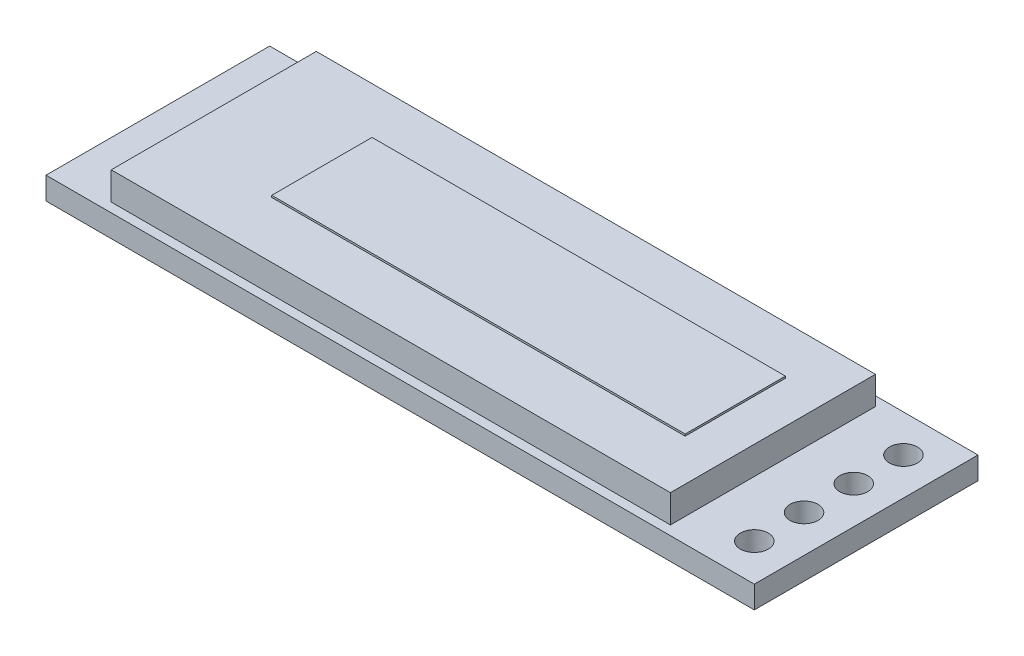
from build123d import *

# Parameters (mm, degrees)
SKETCH_1_W          = 38
SKETCH_1_H          = 12
EXTRUDE_1_DEPTH     = 1.2
SKETCH_2_W          = 30
SKETCH_2_H          = 11
EXTRUDE_2_DEPTH     = 2.7
SKETCH_3_R          = 0.75
CUT_EXTRUDE_2_DEPTH = 39.565399
EXTRUDE_START       = 1.2
SKETCH_4_W          = 2
SKETCH_4_H          = 10
SKETCH_4_H_2        = 1.370131764
EXTRUDE_3_DEPTH     = 2
SKETCH_5_W          = 22.18
SKETCH_5_H          = 5.38
EXTRUDE_4_DEPTH     = 0.1


with BuildPart() as part:
    # Эскиз1 → Бобышка-Вытянуть1 (new body)
    with BuildSketch(Plane(origin=(0, 0, 0), x_dir=(1, 0, 0), z_dir=(0, 1, 0))):
        with Locations((-19, 0)):
            Rectangle(SKETCH_1_W, SKETCH_1_H)
    extrude(amount=EXTRUDE_1_DEPTH)

    # Эскиз2 → Бобышка-Вытянуть2 (add)
    with BuildSketch(Plane(origin=(0, 0, 0), x_dir=(1, 0, 0), z_dir=(0, 1, 0))):
        with Locations((-20, 0)):
            Rectangle(SKETCH_2_W, SKETCH_2_H)
    extrude(amount=EXTRUDE_2_DEPTH)

    # Эскиз3 → Вырез-Вытянуть2 (cut, through all)
    with BuildSketch(Plane(origin=(0, 0, 0), x_dir=(1, 0, 0), z_dir=(0, 1, 0))):
        with Locations(Location((-2, 4, 0), (0, 0, 90))):
            Circle(SKETCH_3_R)
        with Locations(Location((-2, 1.333333333, 0), (0, 0, 90))):
            Circle(SKETCH_3_R)
        with Locations(Location((-2, -1.333333333, 0), (0, 0, 90))):
            Circle(SKETCH_3_R)
        with Locations(Location((-2, -4, 0), (0, 0, 90))):
            Circle(SKETCH_3_R)
    extrude(amount=CUT_EXTRUDE_2_DEPTH, mode=Mode.SUBTRACT)

    # Эскиз4 → Бобышка-Вытянуть3 (add)
    with BuildSketch(Plane(origin=(0, 0, 0), x_dir=(1, 0, 0), z_dir=(0, 1, 0)).offset(EXTRUDE_START)):
        with Locations((-23, 0)):
            Rectangle(SKETCH_4_W, SKETCH_4_H)
        with Locations((-16, 0)):
            Rectangle(SKETCH_4_W, SKETCH_4_H)
        with Locations((-10.327262123, 1.918184469)):
            Rectangle(SKETCH_4_W, SKETCH_4_H_2)
    extrude(amount=-EXTRUDE_3_DEPTH)

    # Эскиз5 → Бобышка-Вытянуть4 (add)
    with BuildSketch(Plane(origin=(0, 2.7, 0), x_dir=(1, 0, 0), z_dir=(0, 1, 0))):
        with Locations((-18.32, 0.21)):
            Rectangle(SKETCH_5_W, SKETCH_5_H)
    extrude(amount=EXTRUDE_4_DEPTH)


solid = part.part
